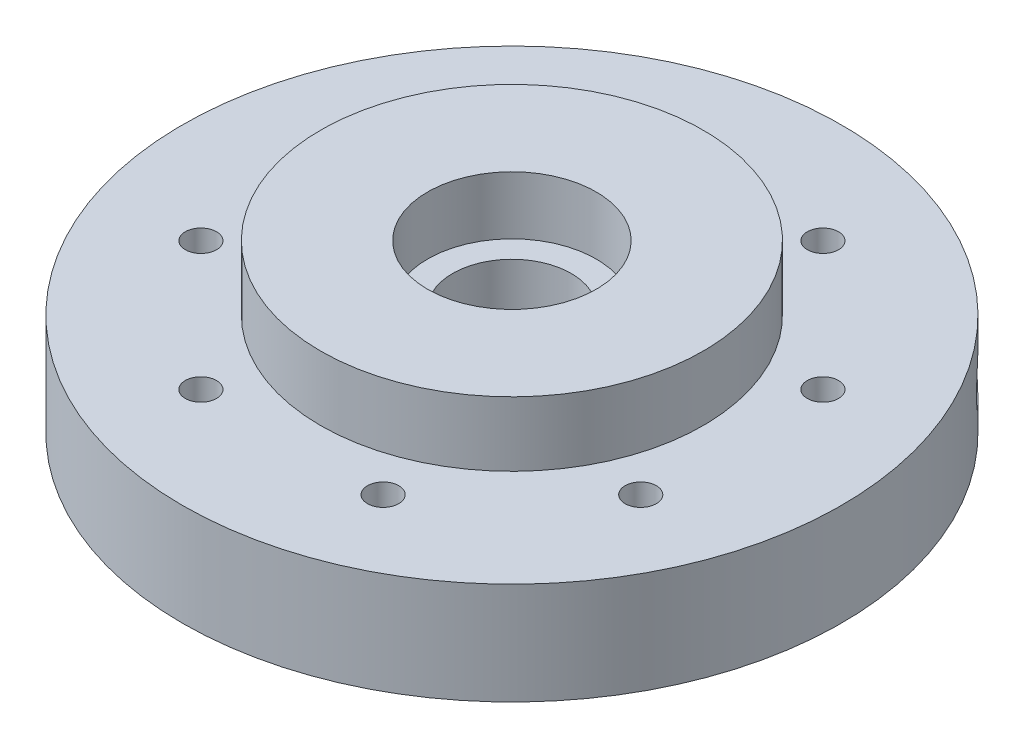
from build123d import *

# Parameters (mm, degrees)
SKETCH1_R                   = 52.75
BASE_DEPTH                  = 16.334375
SKETCH3_R                   = 3.5
SQUARE_BOLT_HOLES_DEPTH     = 14.334375
SKETCH4_R                   = 2.5
HOUSING_BOLTS_DEPTH         = 44.33
CIRPATTERN1_COUNT           = 8
SKETCH2_R                   = 30.626685
IMPELLER_CAVITY_RISER_DEPTH = 10.32955
SKETCH5_R                   = 13.5
SEAL_BORE_DEPTH             = 9.3
SKETCH6_R                   = 9.5
BORE_DEPTH                  = 39.3
SKETCH9_R                   = 1.5875
PRESSURE_TAP_DEPTH          = 52.75
SKETCH10_R                  = 4.1671875
PRESSURE_TAP_BORE_DEPTH     = 12


with BuildPart() as part:
    # Sketch1 → base (new body)
    with BuildSketch(Plane(origin=(0, 0, 0), x_dir=(1, 0, 0), z_dir=(0, 1, 0))):
        with Locations(Location((0, 0, 0), (0, 0, 270))):
            Circle(SKETCH1_R)
    extrude(amount=BASE_DEPTH)

    # Sketch3 → square bolt holes (cut)
    with BuildSketch(Plane.XZ):
        with Locations(Location((-40.75, 0, 0), (0, 0, 270))):
            Circle(SKETCH3_R)
        with Locations(Location((0, 40.75, 0), (0, 0, 270))):
            Circle(SKETCH3_R)
        with Locations(Location((40.75, 0, 0), (0, 0, 270))):
            Circle(SKETCH3_R)
        with Locations(Location((0, -40.75, 0), (0, 0, 270))):
            Circle(SKETCH3_R)
    extrude(amount=-SQUARE_BOLT_HOLES_DEPTH, mode=Mode.SUBTRACT)

    # Sketch4 → housing bolts (cut)
    with BuildSketch(Plane(origin=(0, 16.334375, 0), x_dir=(1, 0, 0), z_dir=(0, 1, 0))):
        with Locations(Location((14.580238773, 35.199810189, 0), (0, 0, 270))):
            Circle(SKETCH4_R)
    housing_bolts = extrude(amount=-HOUSING_BOLTS_DEPTH, mode=Mode.SUBTRACT)

    # CirPattern1: housing bolts ×8 about axis
    cirpattern1_axis = Axis((0, 0, 0), (0, 1, 0))
    for i in range(1, CIRPATTERN1_COUNT):
        add(housing_bolts.rotate(cirpattern1_axis, i * 360 / CIRPATTERN1_COUNT), mode=Mode.SUBTRACT)

    # Sketch2 → impeller cavity riser (add)
    with BuildSketch(Plane(origin=(0, 16.334375, 0), x_dir=(1, 0, 0), z_dir=(0, 1, 0))):
        with Locations(Location((0, 0, 0), (0, 0, 270))):
            Circle(SKETCH2_R)
    extrude(amount=IMPELLER_CAVITY_RISER_DEPTH)

    # Sketch5 → seal bore (cut)
    with BuildSketch(Plane(origin=(0, 26.663925, 0), x_dir=(1, 0, 0), z_dir=(0, 1, 0))):
        with Locations(Location((0, 0, 0), (0, 0, 270))):
            Circle(SKETCH5_R)
    extrude(amount=-SEAL_BORE_DEPTH, mode=Mode.SUBTRACT)

    # Sketch6 → bore (cut)
    with BuildSketch(Plane(origin=(0, 17.363925, 0), x_dir=(1, 0, 0), z_dir=(0, 1, 0))):
        with Locations(Location((0, 0, 0), (0, 0, 270))):
            Circle(SKETCH6_R)
    extrude(amount=-BORE_DEPTH, mode=Mode.SUBTRACT)

    # Sketch9 → pressure tap (cut)
    with BuildSketch(Plane(origin=(37.299882708, 0, -37.299882708), x_dir=(-0.7071067811865462, 0, -0.7071067811865489), z_dir=(0.7071067811865489, 0, -0.7071067811865462))):
        with Locations((0, 8.1671875)):
            Circle(SKETCH9_R)
    extrude(amount=-PRESSURE_TAP_DEPTH, mode=Mode.SUBTRACT)

    # Sketch10 → pressure tap bore (cut)
    with BuildSketch(Plane(origin=(37.299882708, 0, -37.299882708), x_dir=(-0.7071067811865462, 0, -0.7071067811865489), z_dir=(0.7071067811865489, 0, -0.7071067811865462))):
        with Locations((0, 8.1671875)):
            Circle(SKETCH10_R)
    extrude(amount=-PRESSURE_TAP_BORE_DEPTH, mode=Mode.SUBTRACT)


solid = part.part
